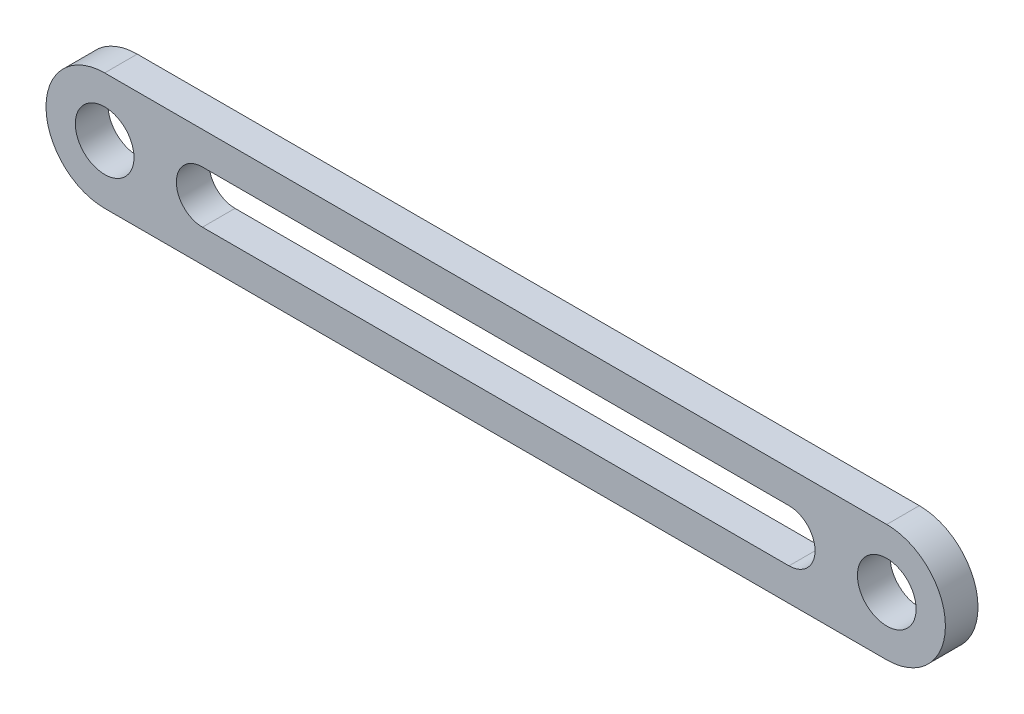
from build123d import *

# Parameters (mm, degrees)
SKETCH1_R           = 4.5
BOSS_EXTRUDE1_DEPTH = 5
CUT_EXTRUDE1_DEPTH  = 10


with BuildPart() as part:
    # Sketch1 → Boss-Extrude1 (new body)
    with BuildSketch(Plane.XY):
        with BuildLine():
            Line((-60, 9), (60, 9))
            ThreePointArc((60, 9), (69, 0), (60, -9))
            Line((60, -9), (-60, -9))
            ThreePointArc((-60, -9), (-69, 0), (-60, 9))
        make_face()
        with Locations((-60, 0)):
            Circle(SKETCH1_R, mode=Mode.SUBTRACT)
        with Locations((60, 0)):
            Circle(SKETCH1_R, mode=Mode.SUBTRACT)
    extrude(amount=BOSS_EXTRUDE1_DEPTH)

    # Sketch2 → Cut-Extrude1 (cut)
    with BuildSketch(Plane.XY.offset(5)):
        with BuildLine():
            Line((-45, 4), (45, 4))
            ThreePointArc((45, 4), (49, 0), (45, -4))
            Line((45, -4), (-45, -4))
            ThreePointArc((-45, -4), (-49, 0), (-45, 4))
        make_face()
    extrude(amount=-CUT_EXTRUDE1_DEPTH, mode=Mode.SUBTRACT)


solid = part.part
